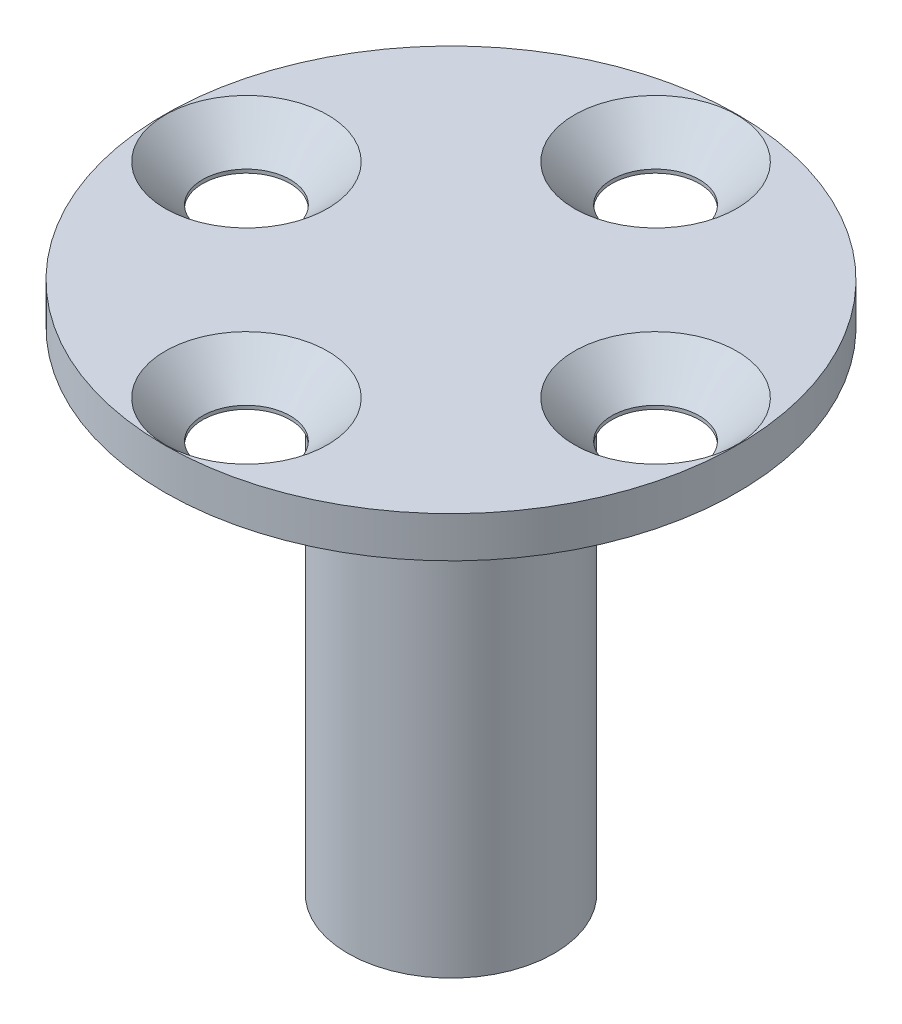
from build123d import *

# Parameters (mm, degrees)
SKETCH1_R                                      = 4
BOSS_EXTRUDE1_DEPTH                            = 19.05
SKETCH2_R                                      = 11.1125
BOSS_EXTRUDE2_DEPTH                            = 3.175
CUT_EXTRUDE2_START                             = -1.5875
SKETCH10_R                                     = 11.1125
CUT_EXTRUDE2_DEPTH                             = 1.5875
CSK_FOR_M3_FLAT_HEAD_MACHINE_SCREW1_AT_2_COUNT = 2
CSK_FOR_M3_FLAT_HEAD_MACHINE_SCREW1_AT_2_PITCH = 11.225320151
CSK_FOR_M3_FLAT_HEAD_MACHINE_SCREW1_AT_3_COUNT = 2
CSK_FOR_M3_FLAT_HEAD_MACHINE_SCREW1_AT_3_PITCH = 11.225320151
CSK_FOR_M3_FLAT_HEAD_MACHINE_SCREW1_AT_4_COUNT = 2
CSK_FOR_M3_FLAT_HEAD_MACHINE_SCREW1_AT_4_PITCH = 15.875


with BuildPart() as part:
    # Sketch1 → Boss-Extrude1 (new body)
    with BuildSketch(Plane(origin=(0, 0, 0), x_dir=(1, 0, 0), z_dir=(0, 1, 0))):
        with Locations(Location((0, 0, 0), (0, 0, 270))):
            Circle(SKETCH1_R)
    extrude(amount=-BOSS_EXTRUDE1_DEPTH)

    # Sketch2 → Boss-Extrude2 (add)
    with BuildSketch(Plane(origin=(0, 0, 0), x_dir=(1, 0, 0), z_dir=(0, 1, 0))):
        with Locations(Location((0, 0, 0), (0, 0, 270))):
            Circle(SKETCH2_R)
    extrude(amount=BOSS_EXTRUDE2_DEPTH)

    # Sketch10 → Cut-Extrude2 (cut)
    with BuildSketch(Plane(origin=(0, 3.175, 0), x_dir=(1, 0, 0), z_dir=(0, 1, 0)).offset(CUT_EXTRUDE2_START)):
        with Locations(Location((0, 0, 0), (0, 0, 270))):
            Circle(SKETCH10_R)
    extrude(amount=CUT_EXTRUDE2_DEPTH, mode=Mode.SUBTRACT)

    # Sketch6 → CSK for M3 Flat Head Machine Screw1 (revolve, cut)
    with BuildSketch(Plane(origin=(7.9375, 1.5875, 0), x_dir=(0, 0, 1), z_dir=(1, 0, 0))):
        Polygon((0, 0), (0, 1.5875), (1.7, 1.5875), (1.7, 1.45), (3.15, 0), align=None)
    csk_for_m3_flat_head_machine_screw1 = revolve(axis=Axis((7.9375, 7.9375, 0), (0, -1, 0)), mode=Mode.SUBTRACT)

    # CSK for M3 Flat Head Machine Screw1 at 2: CSK for M3 Flat Head Machine Screw1 ×2
    with Locations(*[Vector(-0.7071067811865476, 0, -0.7071067811865476) * (i * CSK_FOR_M3_FLAT_HEAD_MACHINE_SCREW1_AT_2_PITCH) for i in range(1, CSK_FOR_M3_FLAT_HEAD_MACHINE_SCREW1_AT_2_COUNT)]):
        add(csk_for_m3_flat_head_machine_screw1, mode=Mode.SUBTRACT)

    # CSK for M3 Flat Head Machine Screw1 at 3: CSK for M3 Flat Head Machine Screw1 ×2
    with Locations(*[Vector(-0.7071067811865476, 0, 0.7071067811865476) * (i * CSK_FOR_M3_FLAT_HEAD_MACHINE_SCREW1_AT_3_PITCH) for i in range(1, CSK_FOR_M3_FLAT_HEAD_MACHINE_SCREW1_AT_3_COUNT)]):
        add(csk_for_m3_flat_head_machine_screw1, mode=Mode.SUBTRACT)

    # CSK for M3 Flat Head Machine Screw1 at 4: CSK for M3 Flat Head Machine Screw1 ×2
    with Locations(*[(-i * CSK_FOR_M3_FLAT_HEAD_MACHINE_SCREW1_AT_4_PITCH, 0, 0) for i in range(1, CSK_FOR_M3_FLAT_HEAD_MACHINE_SCREW1_AT_4_COUNT)]):
        add(csk_for_m3_flat_head_machine_screw1, mode=Mode.SUBTRACT)


solid = part.part
